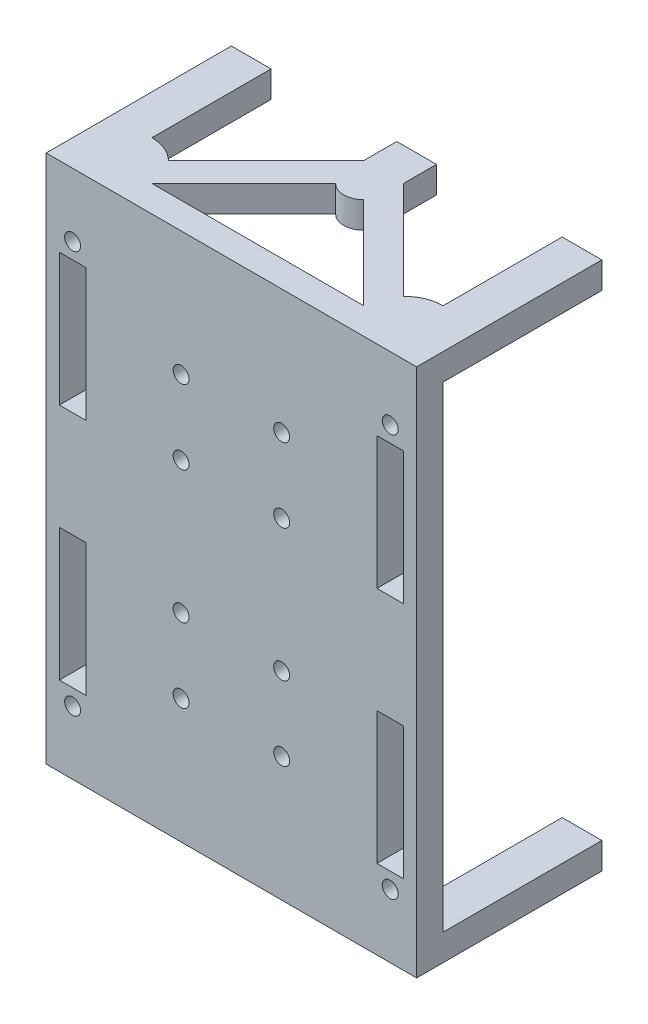
from build123d import *

# Parameters (mm, degrees)
SKETCH1_W           = 70
SKETCH1_H           = 100
BOSS_EXTRUDE1_DEPTH = 2.5
SKETCH2_R           = 1.5
CUT_EXTRUDE1_DEPTH  = 10
BOSS_EXTRUDE2_DEPTH = 5
SKETCH4_W           = 5
SKETCH4_H           = 25
SKETCH4_R           = 1.5
CUT_EXTRUDE2_DEPTH  = 5
SKETCH7_R           = 1.5
CUT_EXTRUDE3_DEPTH  = 5


with BuildPart() as part:
    # Sketch1 → Boss-Extrude1 (new, symmetric)
    with BuildSketch(Plane.XY):
        Rectangle(SKETCH1_W, SKETCH1_H)
    extrude(amount=BOSS_EXTRUDE1_DEPTH, both=True)

    # Sketch2 → Cut-Extrude1 (cut)
    with BuildSketch(Plane(origin=(0, 0, -2.5), x_dir=(-1, 0, 0), z_dir=(0, 0, -1))):
        with Locations((30, 38)):
            Circle(SKETCH2_R)
        with Locations((-30, 38)):
            Circle(SKETCH2_R)
        with Locations((30, -38)):
            Circle(SKETCH2_R)
        with Locations((-30, -38)):
            Circle(SKETCH2_R)
    extrude(amount=-CUT_EXTRUDE1_DEPTH, mode=Mode.SUBTRACT)

    # Sketch3 → Boss-Extrude2 (add)
    with BuildSketch(Plane(origin=(0, 50, 0), x_dir=(1, 0, 0), z_dir=(0, 1, 0))):
        with BuildLine():
            Line((-35, 2.5), (-35, 32.5))
            Line((-35, 32.5), (-27.5, 32.5))
            Line((-27.5, 32.5), (-27.5, 10))
            ThreePointArc((-27.5, 10), (-24.629874257, 9.429096494), (-22.196699141, 7.803300859))
            Line((-22.196699141, 7.803300859), (-3.75, 26.25))
            Line((-3.75, 26.25), (-3.75, 32.5))
            Line((-3.75, 32.5), (3.75, 32.5))
            Line((3.75, 32.5), (3.75, 26.25))
            Line((3.75, 26.25), (22.196699141, 7.803300859))
            ThreePointArc((22.196699141, 7.803300859), (24.629874257, 9.429096494), (27.5, 10))
            Line((27.5, 10), (27.5, 32.5))
            Line((27.5, 32.5), (35, 32.5))
            Line((35, 32.5), (35, 2.5))
            Line((35, 2.5), (20, 2.5))
            Line((20, 2.5), (2.651650429, 19.848349571))
            ThreePointArc((2.651650429, 19.848349571), (0, 18.75), (-2.651650429, 19.848349571))
            Line((-2.651650429, 19.848349571), (-20, 2.5))
            Line((-20, 2.5), (-35, 2.5))
        make_face()
    boss_extrude2 = extrude(amount=-BOSS_EXTRUDE2_DEPTH)

    # Mirror1: Boss-Extrude2 across plane
    add(boss_extrude2.mirror(Plane.ZX))

    # Sketch4 → Cut-Extrude2 (cut)
    with BuildSketch(Plane(origin=(0, 0, -2.5), x_dir=(-1, 0, 0), z_dir=(0, 0, -1))):
        with Locations((-30, -22.5)):
            Rectangle(SKETCH4_W, SKETCH4_H)
        with Locations(Location((-9.5, -26.5, 0), (0, 0, 180))):
            Circle(SKETCH4_R)
        with Locations(Location((-9.5, -12.5, 0), (0, 0, 180))):
            Circle(SKETCH4_R)
        with Locations((9.5, -12.5)):
            Circle(SKETCH4_R)
        with Locations((9.5, -26.5)):
            Circle(SKETCH4_R)
        with Locations((30, -22.5)):
            Rectangle(SKETCH4_W, SKETCH4_H)
        with Locations((30, 22.5)):
            Rectangle(SKETCH4_W, SKETCH4_H)
        with Locations(Location((9.5, 12.5, 0), (0, 0, 180))):
            Circle(SKETCH4_R)
        with Locations(Location((9.5, 26.5, 0), (0, 0, 180))):
            Circle(SKETCH4_R)
        with Locations((-9.5, 26.5)):
            Circle(SKETCH4_R)
        with Locations((-9.5, 12.5)):
            Circle(SKETCH4_R)
        with Locations((-30, 22.5)):
            Rectangle(SKETCH4_W, SKETCH4_H)
    extrude(amount=-CUT_EXTRUDE2_DEPTH, mode=Mode.SUBTRACT)

    # Sketch7 → Cut-Extrude3 (cut)
    with BuildSketch(Plane(origin=(0, 0, -32.5), x_dir=(-1, 0, 0), z_dir=(0, 0, -1))):
        with Locations((0, 47.5)):
            Circle(SKETCH7_R)
        with Locations((-31.25, 47.5)):
            Circle(SKETCH7_R)
        with Locations((31.25, 47.5)):
            Circle(SKETCH7_R)
    cut_extrude3 = extrude(amount=-CUT_EXTRUDE3_DEPTH, mode=Mode.SUBTRACT)

    # Mirror2: Cut-Extrude3 across plane
    add(cut_extrude3.mirror(Plane.ZX), mode=Mode.SUBTRACT)


solid = part.part
